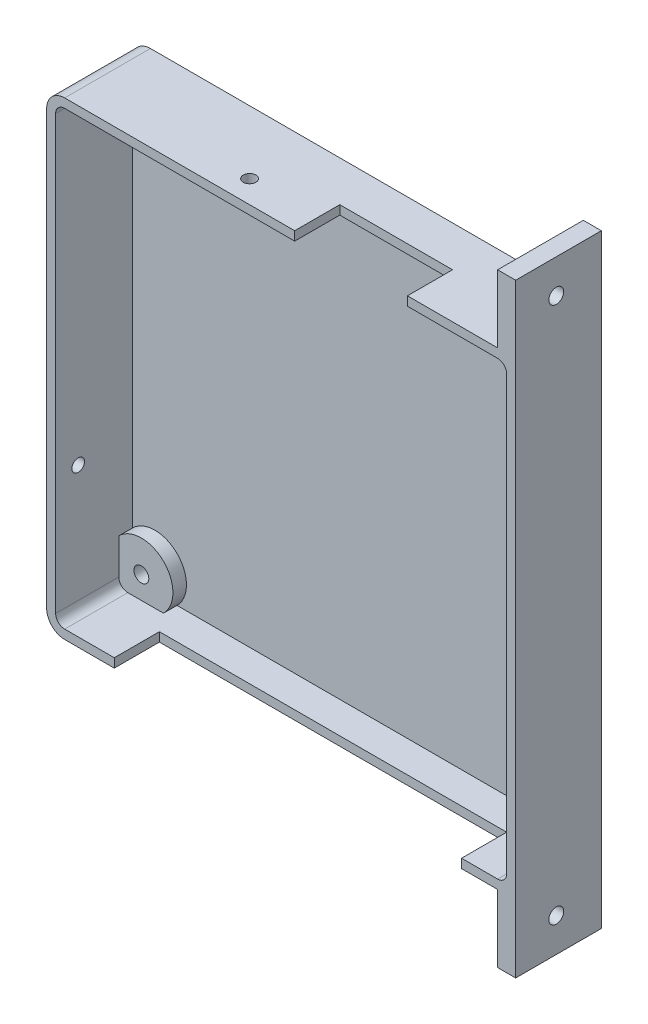
from build123d import *

# Parameters (mm, degrees)
SKETCH_1_R          = 1.65
EXTRUDE_1_DEPTH     = 2
SKETCH_2_R          = 7
SKETCH_2_R_2        = 1.65
EXTRUDE_2_DEPTH     = 3
EXTRUDE_3_DEPTH     = 17
EXTRUDE_4_DEPTH     = 19
SKETCH_6_R          = 1.65
CUT_EXTRUDE_1_DEPTH = 10
SKETCH_7_W          = 77
SKETCH_7_H          = 2
CUT_EXTRUDE_2_DEPTH = 10
SKETCH_8_W          = 25
SKETCH_8_H          = 10
CUT_EXTRUDE_3_DEPTH = 10
SKETCH_9_R          = 1.4
CUT_EXTRUDE_4_DEPTH = 22
SKETCH_10_R         = 1.4
CUT_EXTRUDE_5_DEPTH = 22


with BuildPart() as part:
    # 草图1 → 凸台-拉伸1 (new body)
    with BuildSketch(Plane.XY):
        with BuildLine():
            Line((4, 0), (100, 0))
            ThreePointArc((100, 0), (102.828427125, 1.171572875), (104, 4))
            Line((104, 4), (104, 100))
            ThreePointArc((104, 100), (102.828427125, 102.828427125), (100, 104))
            Line((100, 104), (4, 104))
            ThreePointArc((4, 104), (1.171572875, 102.828427125), (0, 100))
            Line((0, 100), (0, 4))
            ThreePointArc((0, 4), (1.171572875, 1.171572875), (4, 0))
        make_face()
        with Locations((7, 97)):
            Circle(SKETCH_1_R, mode=Mode.SUBTRACT)
        with Locations((97, 97)):
            Circle(SKETCH_1_R, mode=Mode.SUBTRACT)
        with Locations((7, 7)):
            Circle(SKETCH_1_R, mode=Mode.SUBTRACT)
        with Locations((97, 7)):
            Circle(SKETCH_1_R, mode=Mode.SUBTRACT)
    extrude(amount=EXTRUDE_1_DEPTH)

    # 草图2 → 凸台-拉伸2 (add)
    # profile 1 of 4: a face of its own
    with BuildSketch(Plane.XY.offset(2)):
        with Locations(Location((7, 7, 0), (0, 0, 180))):
            Circle(SKETCH_2_R)
        with Locations((7, 7)):
            Circle(SKETCH_2_R_2, mode=Mode.SUBTRACT)
    # profile 2 of 4: a face of its own
    with BuildSketch(Plane.XY.offset(2)):
        with Locations((97, 7)):
            Circle(SKETCH_2_R)
        with Locations((97, 7)):
            Circle(SKETCH_2_R_2, mode=Mode.SUBTRACT)
    # profile 3 of 4: a face of its own
    with BuildSketch(Plane.XY.offset(2)):
        with Locations(Location((7, 97, 0), (0, 0, 180))):
            Circle(SKETCH_2_R)
        with Locations((7, 97)):
            Circle(SKETCH_2_R_2, mode=Mode.SUBTRACT)
    # profile 4 of 4: a face of its own
    with BuildSketch(Plane.XY.offset(2)):
        with Locations((97, 97)):
            Circle(SKETCH_2_R)
        with Locations((97, 97)):
            Circle(SKETCH_2_R_2, mode=Mode.SUBTRACT)
    extrude(amount=EXTRUDE_2_DEPTH)

    # 草图3 → 凸台-拉伸3 (add)
    with BuildSketch(Plane.XY.offset(2)):
        with BuildLine():
            Line((100, 104), (4, 104))
            ThreePointArc((4, 104), (1.171572875, 102.828427125), (0, 100))
            Line((0, 100), (0, 4))
            ThreePointArc((0, 4), (1.171572875, 1.171572875), (4, 0))
            Line((4, 0), (100, 0))
            ThreePointArc((100, 0), (102.828427125, 1.171572875), (104, 4))
            Line((104, 4), (104, 100))
            ThreePointArc((104, 100), (102.828427125, 102.828427125), (100, 104))
        make_face()
        with BuildLine():
            Line((100, 102), (4, 102))
            ThreePointArc((4, 102), (2.585786438, 101.414213562), (2, 100))
            Line((2, 100), (2, 4))
            ThreePointArc((2, 4), (2.585786438, 2.585786438), (4, 2))
            Line((4, 2), (100, 2))
            ThreePointArc((100, 2), (101.414213562, 2.585786438), (102, 4))
            Line((102, 4), (102, 100))
            ThreePointArc((102, 100), (101.414213562, 101.414213562), (100, 102))
        make_face(mode=Mode.SUBTRACT)
    extrude(amount=EXTRUDE_3_DEPTH)

    # 草图5 → 凸台-拉伸4 (add, through all)
    with BuildSketch(Plane.XY.offset(19)):
        with BuildLine():
            Line((104, 4), (104, -15))
            Line((104, -15), (100, -15))
            Line((100, -15), (100, 0))
            ThreePointArc((100, 0), (102.828427125, 1.171572875), (104, 4))
        make_face()
        with BuildLine():
            Line((104, 100), (104, 119))
            Line((104, 119), (100, 119))
            Line((100, 119), (100, 104))
            ThreePointArc((100, 104), (102.828427125, 102.828427125), (104, 100))
        make_face()
    extrude(amount=-EXTRUDE_4_DEPTH)

    # 草图6 → 切除-拉伸1 (cut)
    with BuildSketch(Plane.ZY.offset(-100)):
        with Locations(Location((10, -7.5, 0), (0, 0, 270))):
            Circle(SKETCH_6_R)
        with Locations(Location((10, 111.5, 0), (0, 0, 270))):
            Circle(SKETCH_6_R)
    extrude(amount=-CUT_EXTRUDE_1_DEPTH, mode=Mode.SUBTRACT)

    # 草图7 → 切除-拉伸2 (cut)
    with BuildSketch(Plane.XY.offset(19)):
        with Locations((53.5, 1)):
            Rectangle(SKETCH_7_W, SKETCH_7_H)
    extrude(amount=-CUT_EXTRUDE_2_DEPTH, mode=Mode.SUBTRACT)

    # 草图8 → 切除-拉伸3 (cut)
    with BuildSketch(Plane(origin=(0, 104, 0), x_dir=(1, 0, 0), z_dir=(0, 1, 0))):
        with Locations((67.5, -14)):
            Rectangle(SKETCH_8_W, SKETCH_8_H)
    extrude(amount=-CUT_EXTRUDE_3_DEPTH, mode=Mode.SUBTRACT)

    # 草图9 → 切除-拉伸4 (cut)
    with BuildSketch(Plane(origin=(0, 104, 0), x_dir=(1, 0, 0), z_dir=(0, 1, 0))):
        with Locations(Location((40, -14, 0), (0, 0, 270))):
            Circle(SKETCH_9_R)
    extrude(amount=-CUT_EXTRUDE_4_DEPTH, mode=Mode.SUBTRACT)

    # 草图10 → 切除-拉伸5 (cut)
    with BuildSketch(Plane.ZY):
        with Locations((14, 30)):
            Circle(SKETCH_10_R)
    extrude(amount=-CUT_EXTRUDE_5_DEPTH, mode=Mode.SUBTRACT)


solid = part.part
